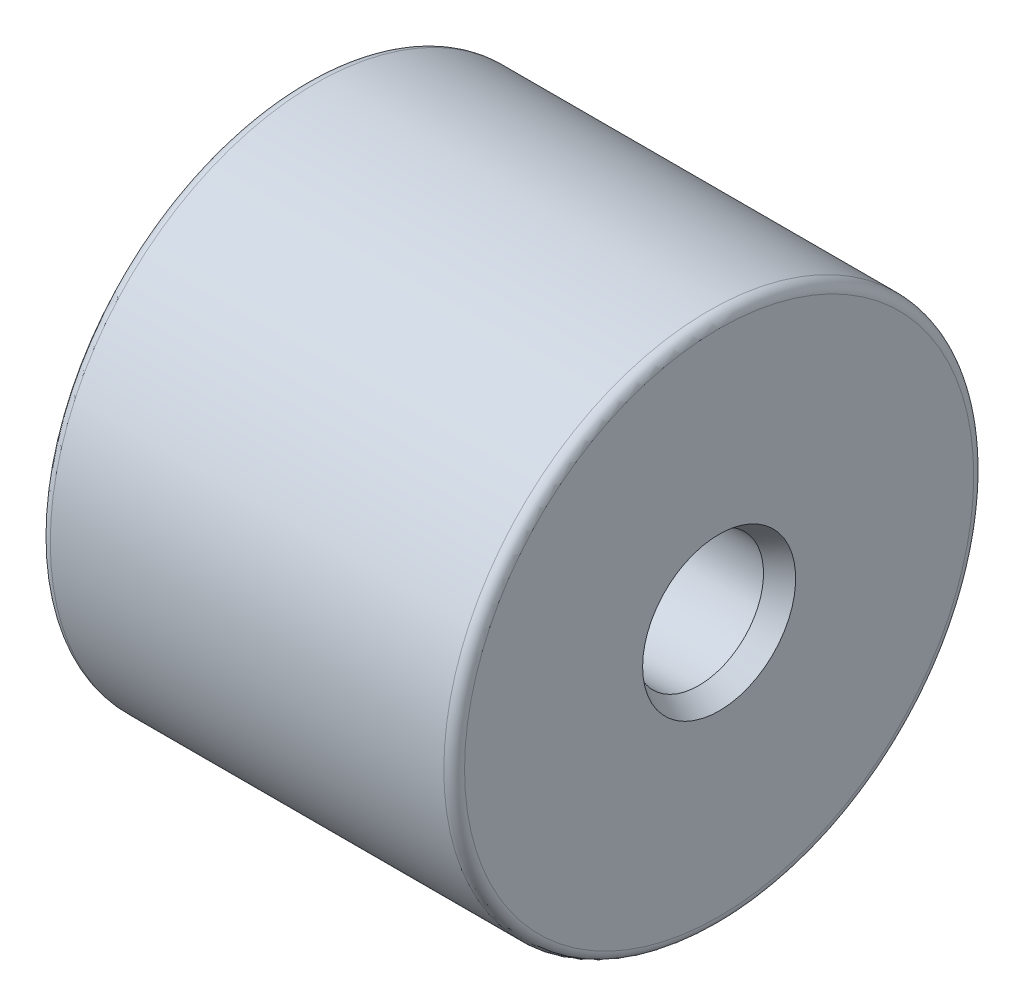
from build123d import *

# Parameters (mm, degrees)
SKETCH1_W      = 30.48
SKETCH1_H      = 14.7295
CHAMFER1_SIZE  = 1.5
CHAMFER1_SIZE2 = 0.866025404
FILLET1_R      = 0.762
CHAMFER2_SIZE  = 1.5
CHAMFER2_SIZE2 = 0.866025404


with BuildPart() as part:
    # Sketch1 → Revolve1 (revolve)
    with BuildSketch(Plane.XY, mode=Mode.PRIVATE) as revolve1_sk:
        with Locations((0, 12.12975)):
            Rectangle(SKETCH1_W, SKETCH1_H)
    revolve(revolve1_sk.sketch.rotate(Axis((-1000, 0, 0), (1, 0, 0)), 90), axis=Axis((-1000, 0, 0), (1, 0, 0)))

    # Chamfer1
    chamfer1_edges = [part.edges().sort_by_distance(p)[0] for p in [
        (-15.24, 0, -4.765),
    ]]
    chamfer1_side = [part.faces().sort_by_distance(p)[0] for p in [
        (0, 0, -4.765),
    ]]
    chamfer(chamfer1_edges, length=CHAMFER1_SIZE, length2=CHAMFER1_SIZE2, reference=chamfer1_side[0])

    # Fillet1
    fillet1_edges = [part.edges().sort_by_distance(p)[0] for p in [
        (15.24, 0, -19.4945),
        (-15.24, 0, -19.4945),
    ]]
    fillet(fillet1_edges, radius=FILLET1_R)

    # Chamfer2
    chamfer2_edges = [part.edges().sort_by_distance(p)[0] for p in [
        (15.24, 0, -4.765),
    ]]
    chamfer2_side = [part.faces().sort_by_distance(p)[0] for p in [
        (0.75, 0, -4.765),
    ]]
    chamfer(chamfer2_edges, length=CHAMFER2_SIZE, length2=CHAMFER2_SIZE2, reference=chamfer2_side[0])


solid = part.part
